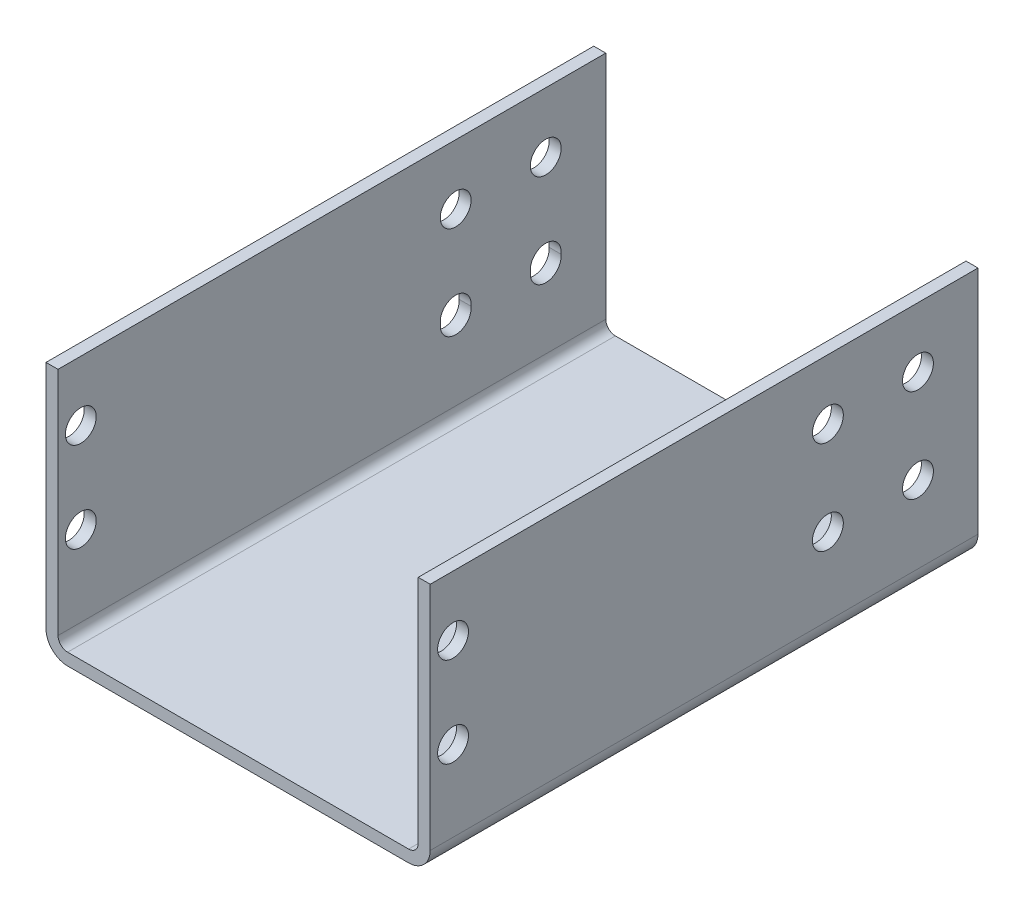
from build123d import *

# Parameters (mm, degrees)
EXTRUDE_THIN1_DEPTH        = 57.935499968
F_4_CLEARANCE_HOLE1_REACH  = 115.405
F_4_CLEARANCE_HOLE1_BORE_R = 1.63195
F_4_CLEARANCE_HOLE2_D      = 3.2639
F_4_CLEARANCE_HOLE3_REACH  = 115.405
F_4_CLEARANCE_HOLE3_BORE_R = 1.63195
F_4_CLEARANCE_HOLE4_D      = 3.2639


with BuildPart() as part:
    # Sketch1 → Extrude-Thin1 (new body)
    with BuildSketch(Plane.XY):
        with BuildLine():
            Line((0, 25.4), (0, 1.016))
            ThreePointArc((0, 1.016), (0.29757951, 0.29757951), (1.016, 0))
            Line((1.016, 0), (37.084, 0))
            ThreePointArc((37.084, 0), (37.80242049, 0.29757951), (38.1, 1.016))
            Line((38.1, 1.016), (38.1, 25.4))
            Line((38.1, 25.4), (39.37, 25.4))
            Line((39.37, 25.4), (39.37, 1.016))
            ThreePointArc((39.37, 1.016), (38.700446102, -0.600446102), (37.084, -1.27))
            Line((37.084, -1.27), (1.016, -1.27))
            ThreePointArc((1.016, -1.27), (-0.600446102, -0.600446102), (-1.27, 1.016))
            Line((-1.27, 1.016), (-1.27, 25.4))
            Line((-1.27, 25.4), (0, 25.4))
        make_face()
    extrude(amount=EXTRUDE_THIN1_DEPTH)

    # #4 Clearance Hole1 bore → #4 Clearance Hole1 (cut, up to next)
    with BuildSketch(Plane(origin=(-1.27, -12.402043901, 98.894849861), x_dir=(0, 0, 1), z_dir=(-1, 0, 0)), mode=Mode.PRIVATE) as f_4_clearance_hole1_sk1:
        with Locations((-92.544849861, 31.452043901)):
            Circle(F_4_CLEARANCE_HOLE1_BORE_R)
    f_4_clearance_hole1_tool1 = extrude(f_4_clearance_hole1_sk1.sketch, amount=-F_4_CLEARANCE_HOLE1_REACH, mode=Mode.PRIVATE) & part.part
    # #4 Clearance Hole1 bore → #4 Clearance Hole1 (cut, up to next)
    with BuildSketch(Plane(origin=(-1.27, -12.402043901, 98.894849861), x_dir=(0, 0, 1), z_dir=(-1, 0, 0)), mode=Mode.PRIVATE) as f_4_clearance_hole1_sk2:
        with Locations((-83.019849861, 31.452043901)):
            Circle(F_4_CLEARANCE_HOLE1_BORE_R)
    f_4_clearance_hole1_tool2 = extrude(f_4_clearance_hole1_sk2.sketch, amount=-F_4_CLEARANCE_HOLE1_REACH, mode=Mode.PRIVATE) & part.part
    # #4 Clearance Hole1 bore → #4 Clearance Hole1 (cut, up to next)
    with BuildSketch(Plane(origin=(-1.27, -12.402043901, 98.894849861), x_dir=(0, 0, 1), z_dir=(-1, 0, 0)), mode=Mode.PRIVATE) as f_4_clearance_hole1_sk3:
        with Locations((-83.019849861, 21.927043901)):
            Circle(F_4_CLEARANCE_HOLE1_BORE_R)
    f_4_clearance_hole1_tool3 = extrude(f_4_clearance_hole1_sk3.sketch, amount=-F_4_CLEARANCE_HOLE1_REACH, mode=Mode.PRIVATE) & part.part
    # #4 Clearance Hole1 bore → #4 Clearance Hole1 (cut, up to next)
    with BuildSketch(Plane(origin=(-1.27, -12.402043901, 98.894849861), x_dir=(0, 0, 1), z_dir=(-1, 0, 0)), mode=Mode.PRIVATE) as f_4_clearance_hole1_sk4:
        with Locations((-92.544849861, 21.927043901)):
            Circle(F_4_CLEARANCE_HOLE1_BORE_R)
    f_4_clearance_hole1_tool4 = extrude(f_4_clearance_hole1_sk4.sketch, amount=-F_4_CLEARANCE_HOLE1_REACH, mode=Mode.PRIVATE) & part.part
    add(f_4_clearance_hole1_tool1.solids().sort_by_distance((-1.27, 19.05, 6.35))[0], mode=Mode.SUBTRACT)
    add(f_4_clearance_hole1_tool2.solids().sort_by_distance((-1.27, 19.05, 15.875))[0], mode=Mode.SUBTRACT)
    add(f_4_clearance_hole1_tool3.solids().sort_by_distance((-1.27, 9.525, 15.875))[0], mode=Mode.SUBTRACT)
    add(f_4_clearance_hole1_tool4.solids().sort_by_distance((-1.27, 9.525, 6.35))[0], mode=Mode.SUBTRACT)

    # #4 Clearance Hole2 (through all)
    with Locations(Plane(origin=(39.37, -12.402043901, 98.894849861), x_dir=(0, 0, -1), z_dir=(1, 0, 0))):
        with Locations((92.544849861, 31.452043901), (83.019849861, 31.452043901), (83.019849861, 21.57276521), (92.544849861, 21.57276521)):
            Hole(F_4_CLEARANCE_HOLE2_D / 2)

    # #4 Clearance Hole3 bore → #4 Clearance Hole3 (cut, up to next)
    with BuildSketch(Plane(origin=(-1.27, -12.402043901, 98.894849861), x_dir=(0, 0, 1), z_dir=(-1, 0, 0)), mode=Mode.PRIVATE) as f_4_clearance_hole3_sk1:
        with Locations((-43.372349893, 31.452043901)):
            Circle(F_4_CLEARANCE_HOLE3_BORE_R)
    f_4_clearance_hole3_tool1 = extrude(f_4_clearance_hole3_sk1.sketch, amount=-F_4_CLEARANCE_HOLE3_REACH, mode=Mode.PRIVATE) & part.part
    # #4 Clearance Hole3 bore → #4 Clearance Hole3 (cut, up to next)
    with BuildSketch(Plane(origin=(-1.27, -12.402043901, 98.894849861), x_dir=(0, 0, 1), z_dir=(-1, 0, 0)), mode=Mode.PRIVATE) as f_4_clearance_hole3_sk2:
        with Locations((-43.372349893, 21.927043901)):
            Circle(F_4_CLEARANCE_HOLE3_BORE_R)
    f_4_clearance_hole3_tool2 = extrude(f_4_clearance_hole3_sk2.sketch, amount=-F_4_CLEARANCE_HOLE3_REACH, mode=Mode.PRIVATE) & part.part
    add(f_4_clearance_hole3_tool1.solids().sort_by_distance((-1.27, 19.05, 55.5225))[0], mode=Mode.SUBTRACT)
    add(f_4_clearance_hole3_tool2.solids().sort_by_distance((-1.27, 9.525, 55.5225))[0], mode=Mode.SUBTRACT)

    # #4 Clearance Hole4 (through all)
    with Locations(Plane(origin=(39.37, -12.402043901, 98.894849861), x_dir=(0, 0, -1), z_dir=(1, 0, 0))):
        with Locations((43.372349893, 21.927043901), (43.372349893, 31.452043901)):
            Hole(F_4_CLEARANCE_HOLE4_D / 2)


solid = part.part
